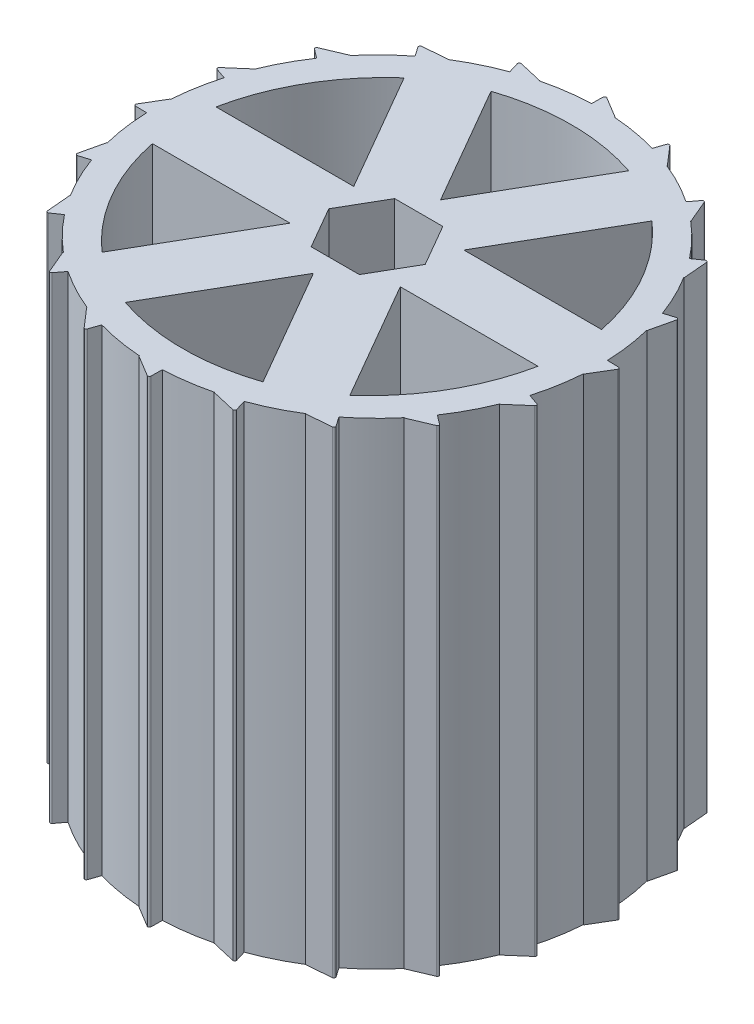
from build123d import *

# Parameters (mm, degrees)
SKETCH1_R           = 35.56
BOSS_EXTRUDE1_DEPTH = 76.2
CUT_EXTRUDE1_DEPTH  = 76.2
CUT_EXTRUDE2_DEPTH  = 76.2
BOSS_EXTRUDE2_DEPTH = 76.2
FILLET1_R           = 0.254


with BuildPart() as part:
    # Sketch1 → Boss-Extrude1 (new body)
    with BuildSketch(Plane(origin=(0, 0, 0), x_dir=(1, 0, 0), z_dir=(0, 1, 0))):
        with Locations(Location((0, 0, 0), (0, 0, 90))):
            Circle(SKETCH1_R)
    extrude(amount=BOSS_EXTRUDE1_DEPTH)

    # Sketch2 → Cut-Extrude1 (cut)
    with BuildSketch(Plane(origin=(0, 76.2, 0), x_dir=(1, 0, 0), z_dir=(0, 1, 0))):
        Polygon((7.69896584, 0), (3.84948292, 6.6675), (-3.84948292, 6.6675), (-7.69896584, 0), (-3.84948292, -6.6675), (3.84948292, -6.6675), align=None)
    extrude(amount=-CUT_EXTRUDE1_DEPTH, mode=Mode.SUBTRACT)

    # Sketch3 → Cut-Extrude2 (cut)
    with BuildSketch(Plane(origin=(0, 76.2, 0), x_dir=(1, 0, 0), z_dir=(0, 1, 0))):
        with BuildLine():
            Line((8.798818102, 5.08), (30.795863359, 5.08))
            ThreePointArc((30.795863359, 5.08), (26.854956532, 15.504716383), (19.797340731, 24.13))
            Line((19.797340731, 24.13), (8.798818102, 5.08))
        make_face()
        with BuildLine():
            Line((0, 10.16), (10.998522628, 29.21))
            ThreePointArc((10.998522628, 29.21), (0, 31.009432765), (-10.998522628, 29.21))
            Line((-10.998522628, 29.21), (0, 10.16))
        make_face()
        with BuildLine():
            Line((8.798818102, -5.08), (19.797340731, -24.13))
            ThreePointArc((19.797340731, -24.13), (26.854956532, -15.504716383), (30.795863359, -5.08))
            Line((30.795863359, -5.08), (8.798818102, -5.08))
        make_face()
        with BuildLine():
            Line((0, -10.16), (-10.998522628, -29.21))
            ThreePointArc((-10.998522628, -29.21), (0, -31.009432765), (10.998522628, -29.21))
            Line((10.998522628, -29.21), (0, -10.16))
        make_face()
        with BuildLine():
            Line((-8.798818102, -5.08), (-30.795863359, -5.08))
            ThreePointArc((-30.795863359, -5.08), (-26.854956532, -15.504716383), (-19.797340731, -24.13))
            Line((-19.797340731, -24.13), (-8.798818102, -5.08))
        make_face()
        with BuildLine():
            Line((-8.798818102, 5.08), (-19.797340731, 24.13))
            ThreePointArc((-19.797340731, 24.13), (-26.854956532, 15.504716383), (-30.795863359, 5.08))
            Line((-30.795863359, 5.08), (-8.798818102, 5.08))
        make_face()
    extrude(amount=-CUT_EXTRUDE2_DEPTH, mode=Mode.SUBTRACT)

    # Sketch4 → Boss-Extrude2 (add)
    with BuildSketch(Plane(origin=(0, 76.2, 0), x_dir=(1, 0, 0), z_dir=(0, 1, 0))):
        Polygon((10.506917468, 36.313470126), (9.069726639, 32.155431824), (13.389288853, 32.989807207), align=None)
        Polygon((2.539559344, 35.512688914), (-1.22880707, 37.782978449), (-1.310752274, 33.384332637), align=None)
        Polygon((21.214151718, 31.289346337), (18.562397516, 27.778933305), (22.92838148, 27.237653318), align=None)
        Polygon((29.84479699, 23.202403322), (26.238051593, 20.683239247), (30.223084377, 18.819288146), align=None)
        Polygon((35.554025592, 12.84424741), (31.345342368, 11.562925622), (34.559341198, 8.558759928), align=None)
        Polygon((37.782978449, 1.22880707), (33.384332637, 1.310752274), (35.512688914, -2.539559344), align=None)
        Polygon((36.313470126, -10.506917468), (32.155431824, -9.069726639), (32.989807207, -13.389288853), align=None)
        Polygon((31.289346337, -21.214151718), (27.778933305, -18.562397516), (27.237653318, -22.92838148), align=None)
        Polygon((23.202403322, -29.84479699), (20.683239247, -26.238051593), (18.819288146, -30.223084377), align=None)
        Polygon((12.84424741, -35.554025592), (11.562925622, -31.345342368), (8.558759928, -34.559341198), align=None)
        Polygon((1.22880707, -37.782978449), (1.310752274, -33.384332637), (-2.539559344, -35.512688914), align=None)
        Polygon((-10.506917468, -36.313470126), (-9.069726639, -32.155431824), (-13.389288853, -32.989807207), align=None)
        Polygon((-21.214151718, -31.289346337), (-18.562397516, -27.778933305), (-22.92838148, -27.237653318), align=None)
        Polygon((-29.84479699, -23.202403322), (-26.238051593, -20.683239247), (-30.223084377, -18.819288146), align=None)
        Polygon((-35.554025592, -12.84424741), (-31.345342368, -11.562925622), (-34.559341198, -8.558759928), align=None)
        Polygon((-37.782978449, -1.22880707), (-33.384332637, -1.310752274), (-35.512688914, 2.539559344), align=None)
        Polygon((-36.313470126, 10.506917468), (-32.155431824, 9.069726639), (-32.989807207, 13.389288853), align=None)
        Polygon((-31.289346337, 21.214151718), (-27.778933305, 18.562397516), (-27.237653318, 22.92838148), align=None)
        Polygon((-23.202403322, 29.84479699), (-20.683239247, 26.238051593), (-18.819288146, 30.223084377), align=None)
        Polygon((-12.84424741, 35.554025592), (-11.562925622, 31.345342368), (-8.558759928, 34.559341198), align=None)
    extrude(amount=-BOSS_EXTRUDE2_DEPTH)

    # Fillet1
    fillet1_edges = [part.edges().sort_by_distance(p)[0] for p in [
        (-1.22880707, 38.1, -37.782978449),
        (10.506917468, 38.1, -36.313470126),
        (21.214151718, 38.1, -31.289346337),
        (29.84479699, 38.1, -23.202403322),
        (35.554025592, 38.1, -12.84424741),
        (37.782978449, 38.1, -1.22880707),
        (36.313470126, 38.1, 10.506917468),
        (31.289346337, 38.1, 21.214151718),
        (23.202403322, 38.1, 29.84479699),
        (12.84424741, 38.1, 35.554025592),
        (1.22880707, 38.1, 37.782978449),
        (-10.506917468, 38.1, 36.313470126),
        (-21.214151718, 38.1, 31.289346337),
        (-29.84479699, 38.1, 23.202403322),
        (-35.554025592, 38.1, 12.84424741),
        (-37.782978449, 38.1, 1.22880707),
        (-36.313470126, 38.1, -10.506917468),
        (-31.289346337, 38.1, -21.214151718),
        (-23.202403322, 38.1, -29.84479699),
        (-12.84424741, 38.1, -35.554025592),
    ]]
    fillet(fillet1_edges, radius=FILLET1_R)


solid = part.part
